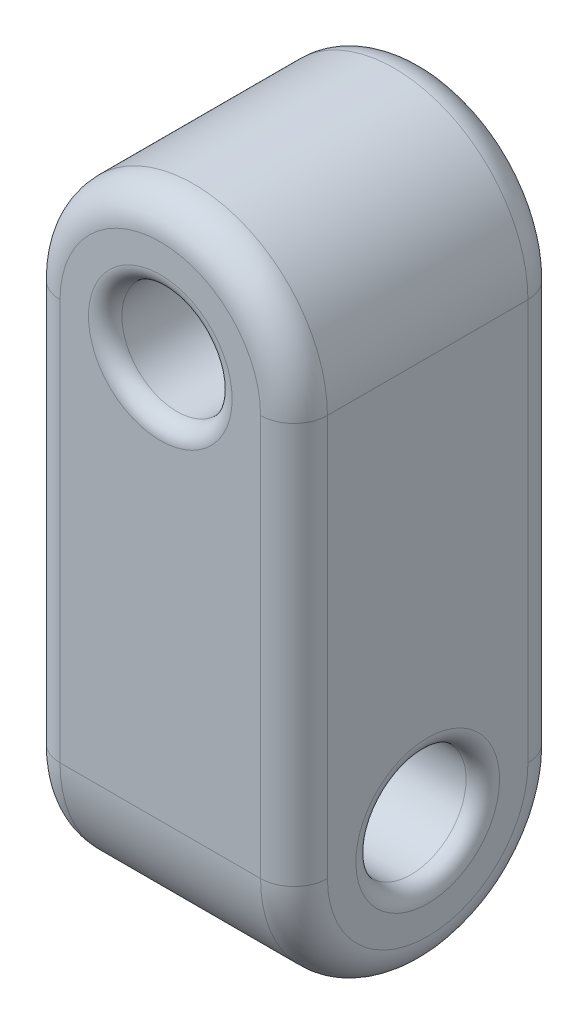
from build123d import *

# Parameters (mm, degrees)
BOSS_EXTRUDE1_START = 0.8
SKETCH2_R           = 4
BOSS_EXTRUDE1_DEPTH = 8
SKETCH10_W          = 8
SKETCH10_H          = 12
BOSS_EXTRUDE2_DEPTH = 8
BOSS_EXTRUDE3_START = 4
SKETCH8_R           = 4
BOSS_EXTRUDE3_DEPTH = 8
SKETCH1_R           = 1.65
CUT_EXTRUDE2_DEPTH  = 9.6
CUT_EXTRUDE3_START  = 4.975
SKETCH9_R           = 1.65
CUT_EXTRUDE3_DEPTH  = 9.95
FILLET1_R           = 1
FILLET2_R           = 0.5


with BuildPart() as part:
    # Sketch2 → Boss-Extrude1 (new body)
    with BuildSketch(Plane.XY.offset(BOSS_EXTRUDE1_START)):
        Circle(SKETCH2_R)
    extrude(amount=BOSS_EXTRUDE1_DEPTH)

    # Sketch10 → Boss-Extrude2 (add)
    with BuildSketch(Plane(origin=(0, 0, 0.8), x_dir=(-1, 0, 0), z_dir=(0, 0, -1))):
        with Locations((0, -6)):
            Rectangle(SKETCH10_W, SKETCH10_H)
    extrude(amount=-BOSS_EXTRUDE2_DEPTH)

    # Sketch8 → Boss-Extrude3 (add)
    with BuildSketch(Plane(origin=(0, 0, 0), x_dir=(0, 0, -1), z_dir=(1, 0, 0)).offset(BOSS_EXTRUDE3_START)):
        with Locations((-4.8, -12)):
            Circle(SKETCH8_R)
    extrude(amount=-BOSS_EXTRUDE3_DEPTH)

    # Sketch1 → Cut-Extrude2 (cut)
    with BuildSketch(Plane.XY):
        Circle(SKETCH1_R)
    extrude(amount=CUT_EXTRUDE2_DEPTH, mode=Mode.SUBTRACT)

    # Sketch9 → Cut-Extrude3 (cut)
    with BuildSketch(Plane(origin=(0, 0, 0), x_dir=(0, 0, -1), z_dir=(1, 0, 0)).offset(CUT_EXTRUDE3_START)):
        with Locations((-4.8, -12)):
            Circle(SKETCH9_R)
    extrude(amount=-CUT_EXTRUDE3_DEPTH, mode=Mode.SUBTRACT)

    # Fillet1
    fillet1_edges = [part.edges().sort_by_distance(p)[0] for p in [
        (-4, -6, 8.8),
        (4, -6, 0.8),
        (0, 4, 0.8),
        (-4, -16, 4.8),
        (4, -16, 4.8),
        (0, 4, 8.8),
        (-4, -6, 0.8),
        (4, -6, 8.8),
    ]]
    fillet(fillet1_edges, radius=FILLET1_R)

    # Fillet2
    fillet2_edges = [part.edges().sort_by_distance(p)[0] for p in [
        (-1.65, 0, 8.8),
        (-1.65, 0, 0.8),
        (-4, -12, 6.45),
        (4, -12, 6.45),
    ]]
    fillet(fillet2_edges, radius=FILLET2_R)


solid = part.part
